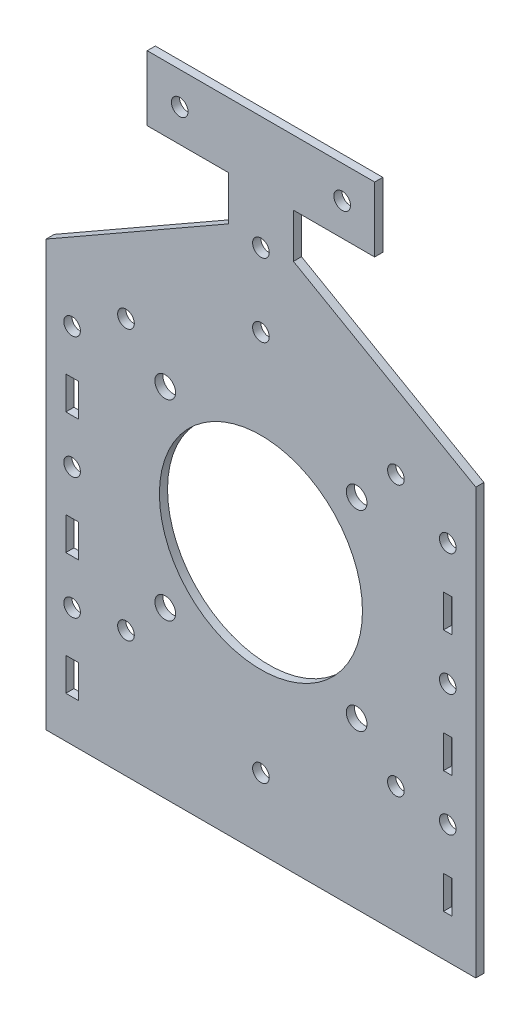
from build123d import *

# Parameters (mm, degrees)
SKETCH_1_R      = 2.55
SKETCH_1_R_2    = 25
SKETCH_1_R_3    = 2.05
SKETCH_1_W      = 2.1
SKETCH_1_H      = 8.1
SKETCH_1_W_2    = 3.1
EXTRUDE_1_DEPTH = 2


with BuildPart() as part:
    # 草图1 → 凸台-拉伸1 (new body)
    with BuildSketch(Plane.XY):
        Polygon((-52.9, 53.883164809), (-52.9, -50.790000001), (52.9, -50.790000001), (52.9, 53.883164809), (8, 79.569735886), (8, 90.5), (28, 90.5), (28, 106.5), (-28, 106.5), (-28, 90.5), (-8, 90.5), (-8, 79.569735886), align=None)
        with Locations((-23.57, 37.07)):
            Circle(SKETCH_1_R, mode=Mode.SUBTRACT)
        with Locations((-23.57, -10.07)):
            Circle(SKETCH_1_R, mode=Mode.SUBTRACT)
        with Locations((23.57, -10.07)):
            Circle(SKETCH_1_R, mode=Mode.SUBTRACT)
        with Locations((23.57, 37.07)):
            Circle(SKETCH_1_R, mode=Mode.SUBTRACT)
        with Locations((0, 13.5)):
            Circle(SKETCH_1_R_2, mode=Mode.SUBTRACT)
        with Locations((0, 60.5)):
            Circle(SKETCH_1_R_3, mode=Mode.SUBTRACT)
        with Locations((33.234018716, 46.734018716)):
            Circle(SKETCH_1_R_3, mode=Mode.SUBTRACT)
        with Locations((33.234018716, -19.734018716)):
            Circle(SKETCH_1_R_3, mode=Mode.SUBTRACT)
        with Locations((0, -33.5)):
            Circle(SKETCH_1_R_3, mode=Mode.SUBTRACT)
        with Locations((-33.234018716, -19.734018716)):
            Circle(SKETCH_1_R_3, mode=Mode.SUBTRACT)
        with Locations((-33.234018716, 46.734018716)):
            Circle(SKETCH_1_R_3, mode=Mode.SUBTRACT)
        with Locations((0, 78.5)):
            Circle(SKETCH_1_R_3, mode=Mode.SUBTRACT)
        with Locations((-20, 98.5)):
            Circle(SKETCH_1_R_3, mode=Mode.SUBTRACT)
        with Locations((20, 98.5)):
            Circle(SKETCH_1_R_3, mode=Mode.SUBTRACT)
        with Locations((46, 8.5)):
            Circle(SKETCH_1_R_3, mode=Mode.SUBTRACT)
        with Locations((46, -21.5)):
            Circle(SKETCH_1_R_3, mode=Mode.SUBTRACT)
        with Locations((46, 38.5)):
            Circle(SKETCH_1_R_3, mode=Mode.SUBTRACT)
        with Locations((-46.5, -21.5)):
            Circle(SKETCH_1_R_3, mode=Mode.SUBTRACT)
        with Locations((-46.5, 8.5)):
            Circle(SKETCH_1_R_3, mode=Mode.SUBTRACT)
        with Locations((-46.5, 38.5)):
            Circle(SKETCH_1_R_3, mode=Mode.SUBTRACT)
        with Locations((46, 23.5)):
            Rectangle(SKETCH_1_W, SKETCH_1_H, mode=Mode.SUBTRACT)
        with Locations((46, -6.5)):
            Rectangle(SKETCH_1_W, SKETCH_1_H, mode=Mode.SUBTRACT)
        with Locations((46, -36.5)):
            Rectangle(SKETCH_1_W, SKETCH_1_H, mode=Mode.SUBTRACT)
        with Locations((-46.5, 23.5)):
            Rectangle(SKETCH_1_W_2, SKETCH_1_H, mode=Mode.SUBTRACT)
        with Locations((-46.5, -6.5)):
            Rectangle(SKETCH_1_W_2, SKETCH_1_H, mode=Mode.SUBTRACT)
        with Locations((-46.5, -36.5)):
            Rectangle(SKETCH_1_W_2, SKETCH_1_H, mode=Mode.SUBTRACT)
    extrude(amount=EXTRUDE_1_DEPTH)


solid = part.part
